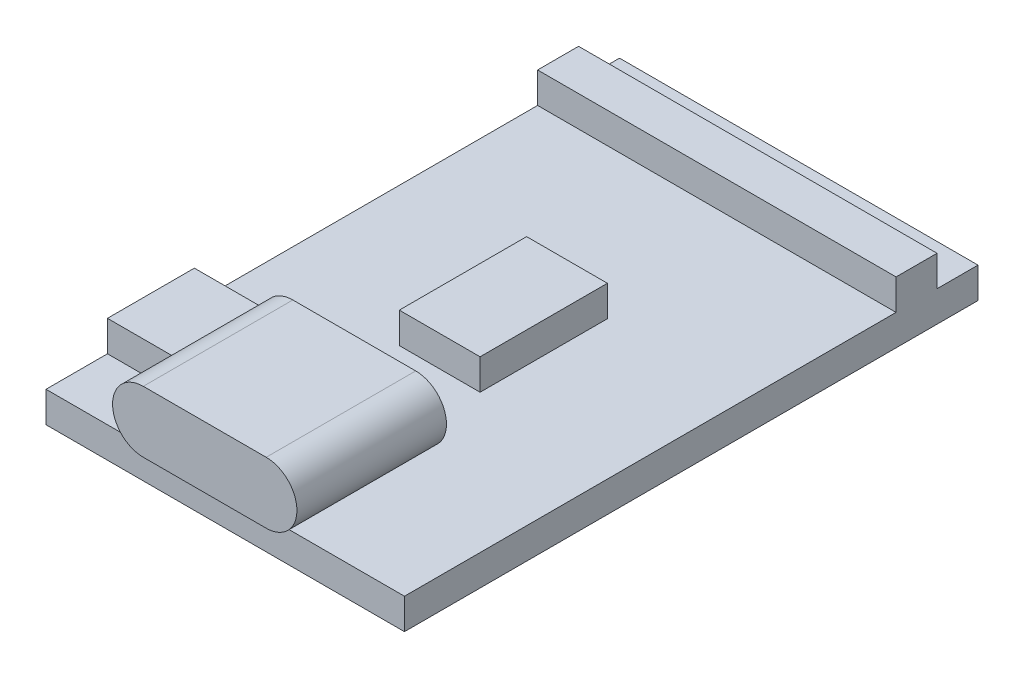
from build123d import *

# Parameters (mm, degrees)
SKETCH_1_W      = 17.5
SKETCH_1_H      = 28
EXTRUDE_1_DEPTH = 1.5
EXTRUDE_START   = 1
EXTRUDE_2_DEPTH = 7.3
SKETCH_3_W      = 3.944166636
SKETCH_3_H      = 6.215050456
SKETCH_3_W_2    = 3.451271085
SKETCH_3_H_2    = 4.243110314
SKETCH_3_W_3    = 17.5
SKETCH_3_H_3    = 2
EXTRUDE_3_DEPTH = 3


with BuildPart() as part:
    # Эскиз1 → Бобышка-Вытянуть1 (new body)
    with BuildSketch(Plane(origin=(0, 0, 0), x_dir=(1, 0, 0), z_dir=(0, 1, 0))):
        with Locations((0, 14)):
            Rectangle(SKETCH_1_W, SKETCH_1_H)
    extrude(amount=EXTRUDE_1_DEPTH)

    # Эскиз3 → Бобышка-Вытянуть3 (add)
    with BuildSketch(Plane(origin=(0, 0, 0), x_dir=(1, 0, 0), z_dir=(0, 1, 0))):
        with Locations((0, 13.577680972)):
            Rectangle(SKETCH_3_W, SKETCH_3_H)
        with Locations((-7.024364458, 5.121555157)):
            Rectangle(SKETCH_3_W_2, SKETCH_3_H_2)
        with Locations((0, 25)):
            Rectangle(SKETCH_3_W_3, SKETCH_3_H_3)
    extrude(amount=EXTRUDE_3_DEPTH)


with BuildPart() as body_2:
    # Эскиз2 → Бобышка-Вытянуть2 (new body)
    with BuildSketch(Plane.XY.offset(EXTRUDE_START)):
        with BuildLine():
            Line((-3, 5), (3, 5))
            ThreePointArc((3, 5), (4.5, 3.5), (3, 2))
            Line((3, 2), (-3, 2))
            ThreePointArc((-3, 2), (-4.5, 3.5), (-3, 5))
        make_face()
    extrude(amount=-EXTRUDE_2_DEPTH)


solid = Compound([part.part, body_2.part])
